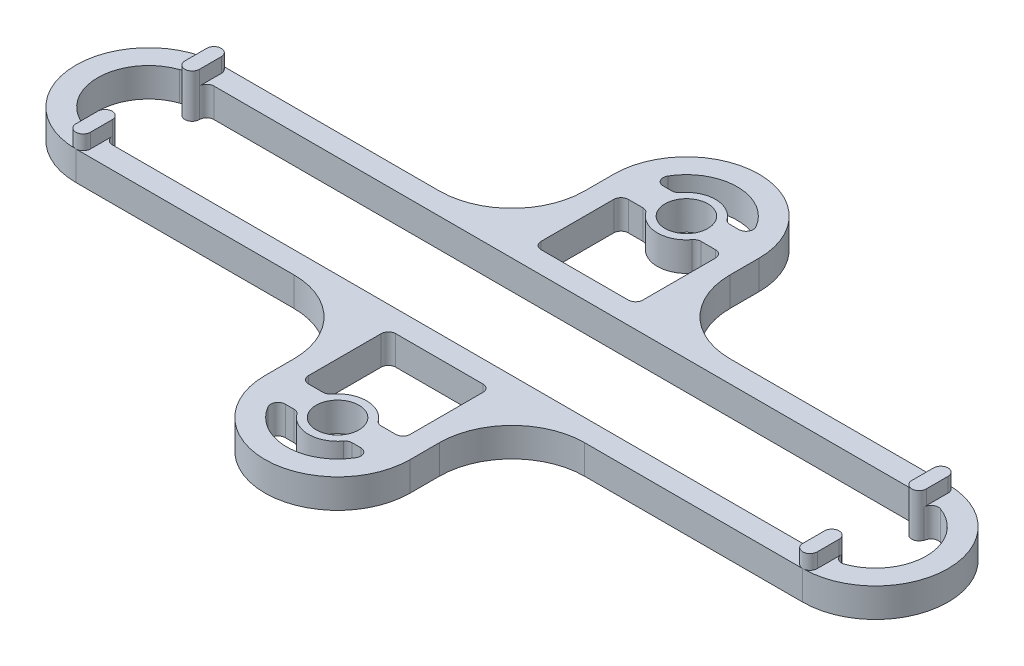
from build123d import *

# Parameters (mm, degrees)
SKETCH1_R                 = 1
BOSS_EXTRUDE1_DEPTH       = 2
BOSS_EXTRUDE2_DEPTH       = 1
SKETCH3_W                 = 49
SKETCH3_H                 = 7
CUT_EXTRUDE1_DEPTH        = 35.539832078
FILLET2_R                 = 0.5
F_4_CLEARANCE_HOLE1_D     = 2.9464
F_4_CLEARANCE_HOLE1_DEPTH = 3
FILLET3_R                 = 5
CUT_EXTRUDE2_DEPTH        = 35.6121366


with BuildPart() as part:
    # Sketch1 → Boss-Extrude1 (new body)
    with BuildSketch(Plane(origin=(0, 0, 0), x_dir=(1, 0, 0), z_dir=(0, 1, 0))):
        with BuildLine():
            Line((-25, 5), (-5, 5))
            Line((-5, 5), (-5, 12))
            ThreePointArc((-5, 12), (0, 17), (5, 12))
            Line((5, 12), (5, 5))
            Line((5, 5), (25, 5))
            ThreePointArc((25, 5), (30, 0), (25, -5))
            Line((25, -5), (5, -5))
            Line((5, -5), (5, -12))
            ThreePointArc((5, -12), (0, -17), (-5, -12))
            Line((-5, -12), (-5, -5))
            Line((-5, -5), (-25, -5))
            ThreePointArc((-25, -5), (-30, 0), (-25, 5))
        make_face()
        with Locations(Location((0, 12, 0), (0, 0, 270))):
            Circle(SKETCH1_R, mode=Mode.SUBTRACT)
        with Locations(Location((0, -12, 0), (0, 0, 270))):
            Circle(SKETCH1_R, mode=Mode.SUBTRACT)
    extrude(amount=BOSS_EXTRUDE1_DEPTH)

    # Sketch2 → Boss-Extrude2 (add)
    with BuildSketch(Plane(origin=(0, 2, 0), x_dir=(1, 0, 0), z_dir=(0, 1, 0))):
        with BuildLine():
            Line((-24.5, 4.5), (-24.5, -4.5))
            ThreePointArc((-24.5, -4.5), (-25, -5), (-25.5, -4.5))
            Line((-25.5, -4.5), (-25.5, 4.5))
            ThreePointArc((-25.5, 4.5), (-25, 5), (-24.5, 4.5))
        make_face()
        with BuildLine():
            Line((25.5, 4.5), (25.5, -4.5))
            ThreePointArc((25.5, -4.5), (25, -5), (24.5, -4.5))
            Line((24.5, -4.5), (24.5, 4.5))
            ThreePointArc((24.5, 4.5), (25, 5), (25.5, 4.5))
        make_face()
    extrude(amount=BOSS_EXTRUDE2_DEPTH)

    # Sketch3 → Cut-Extrude1 (cut, through all)
    with BuildSketch(Plane(origin=(0, 2, 0), x_dir=(1, 0, 0), z_dir=(0, 1, 0))):
        Rectangle(SKETCH3_W, SKETCH3_H)
        with BuildLine():
            Line((-25.5, 3.464101615), (-25.5, -3.464101615))
            ThreePointArc((-25.5, -3.464101615), (-28.5, 0), (-25.5, 3.464101615))
        make_face()
        with BuildLine():
            Line((25.5, 3.464101615), (25.5, -3.464101615))
            ThreePointArc((25.5, -3.464101615), (28.5, 0), (25.5, 3.464101615))
        make_face()
        with BuildLine():
            Line((-1.732050808, 13), (-3.354101966, 13))
            ThreePointArc((-3.354101966, 13), (0, 15.5), (3.354101966, 13))
            Line((3.354101966, 13), (1.732050808, 13))
            ThreePointArc((1.732050808, 13), (0, 14), (-1.732050808, 13))
        make_face()
        with BuildLine():
            Line((-1.732050808, 11), (-3.5, 11))
            Line((-3.5, 11), (-3.5, 5))
            Line((-3.5, 5), (3.5, 5))
            Line((3.5, 5), (3.5, 11))
            Line((3.5, 11), (1.732050808, 11))
            ThreePointArc((1.732050808, 11), (0, 10), (-1.732050808, 11))
        make_face()
        with BuildLine():
            Line((1.732050808, -13), (3.354101966, -13))
            ThreePointArc((3.354101966, -13), (0, -15.5), (-3.354101966, -13))
            Line((-3.354101966, -13), (-1.732050808, -13))
            ThreePointArc((-1.732050808, -13), (0, -14), (1.732050808, -13))
        make_face()
        with BuildLine():
            Line((3.5, -11), (1.732050808, -11))
            ThreePointArc((1.732050808, -11), (0, -10), (-1.732050808, -11))
            Line((-1.732050808, -11), (-3.5, -11))
            Line((-3.5, -11), (-3.5, -5))
            Line((-3.5, -5), (3.5, -5))
            Line((3.5, -5), (3.5, -11))
        make_face()
    extrude(amount=-CUT_EXTRUDE1_DEPTH, mode=Mode.SUBTRACT)

    # Fillet2
    fillet2_edges = [part.edges().sort_by_distance(p)[0] for p in [
        (3.5, 1, 5),
        (3.5, 1, 11),
        (1.732050808, 1, 11),
        (-1.732050808, 1, 11),
        (-3.5, 1, 11),
        (-3.5, 1, 5),
        (-1.732050808, 1, 13),
        (1.732050808, 1, 13),
        (3.354101966, 1, 13),
        (-3.354101966, 1, 13),
        (1.732050808, 1, -13),
        (-1.732050808, 1, -13),
        (-3.354101966, 1, -13),
        (3.354101966, 1, -13),
        (-1.732050808, 1, -11),
        (1.732050808, 1, -11),
        (3.5, 1, -11),
        (3.5, 1, -5),
        (-3.5, 1, -5),
        (-3.5, 1, -11),
        (25.5, 1, -3.464101615),
        (25.5, 1, 3.464101615),
        (-25.5, 1, 3.464101615),
        (-25.5, 1, -3.464101615),
        (-24.5, 1, 3.5),
        (-24.5, 1, -3.5),
        (24.5, 1, -3.5),
        (24.5, 1, 3.5),
    ]]
    fillet(fillet2_edges, radius=FILLET2_R)

    # #4 Clearance Hole1
    with Locations(Plane(origin=(0, 0, 0), x_dir=(-1, 0, 0), z_dir=(0, -1, 0))):
        with Locations((0, 12), (0, -12)):
            Hole(F_4_CLEARANCE_HOLE1_D / 2, depth=F_4_CLEARANCE_HOLE1_DEPTH)

    # Fillet3
    fillet3_edges = [part.edges().sort_by_distance(p)[0] for p in [
        (-5, 1, -5),
        (5, 1, -5),
        (5, 1, 5),
        (-5, 1, 5),
    ]]
    fillet(fillet3_edges, radius=FILLET3_R)

    # Sketch6 → Cut-Extrude2 (cut, through all)
    with BuildSketch(Plane(origin=(0, 3, 0), x_dir=(1, 0, 0), z_dir=(0, 1, 0))):
        with BuildLine():
            Line((-25.5, 3), (-25.5, -3))
            ThreePointArc((-25.5, -3), (-25, -2.5), (-24.5, -3))
            Line((-24.5, -3), (-24.5, 3))
            ThreePointArc((-24.5, 3), (-25, 2.5), (-25.5, 3))
        make_face()
        with BuildLine():
            Line((24.5, 3), (24.5, -3))
            ThreePointArc((24.5, -3), (25, -2.5), (25.5, -3))
            Line((25.5, -3), (25.5, 3))
            ThreePointArc((25.5, 3), (25, 2.5), (24.5, 3))
        make_face()
    extrude(amount=-CUT_EXTRUDE2_DEPTH, mode=Mode.SUBTRACT)


solid = part.part
